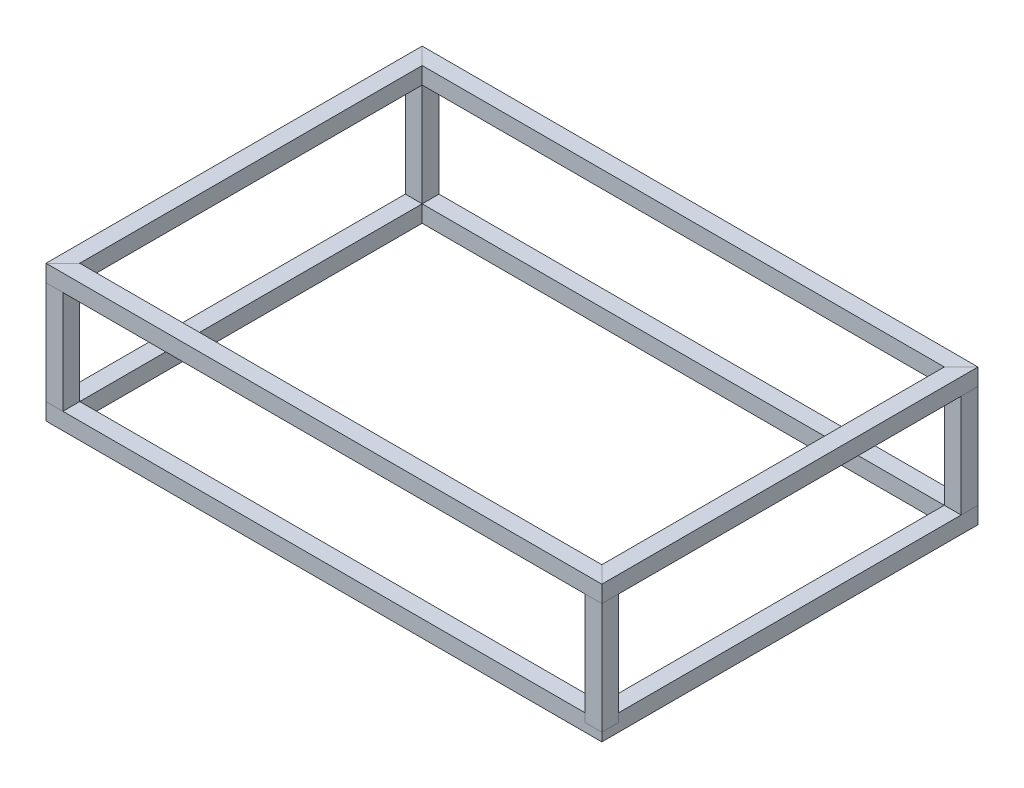
from build123d import *

# Parameters (mm, degrees)
SQUARE_TUBE_25_4X25_4X1_6_IGVC_1_DEPTH      = 935.623253942
SQUARE_TUBE_25_4X25_4X1_6_IGVC_1_DEPTH_BACK = 21.223253942
SKETCH14_W                                  = 28.6
SKETCH14_H                                  = 28.6
SKETCH14_W_2                                = 25.4
SKETCH14_H_2                                = 25.4
SKETCH14_ON_SEGMENT_2_W                     = 28.6
SKETCH14_ON_SEGMENT_2_H                     = 28.6
SKETCH14_ON_SEGMENT_2_W_2                   = 25.4
SKETCH14_ON_SEGMENT_2_H_2                   = 25.4
SQUARE_TUBE_25_4X25_4X1_6_IGVC_1_2_DEPTH    = 652.046507884
SKETCH14_ON_SEGMENT_3_W                     = 28.6
SKETCH14_ON_SEGMENT_3_H                     = 28.6
SKETCH14_ON_SEGMENT_3_W_2                   = 25.4
SKETCH14_ON_SEGMENT_3_H_2                   = 25.4
SQUARE_TUBE_25_4X25_4X1_6_IGVC_1_3_DEPTH    = 956.846507884
SKETCH14_ON_SEGMENT_4_W                     = 28.6
SKETCH14_ON_SEGMENT_4_H                     = 28.6
SKETCH14_ON_SEGMENT_4_W_2                   = 25.4
SKETCH14_ON_SEGMENT_4_H_2                   = 25.4
SQUARE_TUBE_25_4X25_4X1_6_IGVC_1_4_DEPTH    = 652.046507884
SKETCH15_W                                  = 28.6
SKETCH15_H                                  = 28.6
SKETCH15_W_2                                = 25.4
SKETCH15_H_2                                = 25.4
SQUARE_TUBE_25_4X25_4X1_6_IGVC_2_DEPTH      = 203.2
SKETCH15_ON_SEGMENT_2_W                     = 28.6
SKETCH15_ON_SEGMENT_2_H                     = 28.6
SKETCH15_ON_SEGMENT_2_W_2                   = 25.4
SKETCH15_ON_SEGMENT_2_H_2                   = 25.4
SQUARE_TUBE_25_4X25_4X1_6_IGVC_2_2_DEPTH    = 203.2
SKETCH15_ON_SEGMENT_3_W                     = 28.6
SKETCH15_ON_SEGMENT_3_H                     = 28.6
SKETCH15_ON_SEGMENT_3_W_2                   = 25.4
SKETCH15_ON_SEGMENT_3_H_2                   = 25.4
SQUARE_TUBE_25_4X25_4X1_6_IGVC_2_3_DEPTH    = 203.2
SKETCH15_ON_SEGMENT_4_W                     = 28.6
SKETCH15_ON_SEGMENT_4_H                     = 28.6
SKETCH15_ON_SEGMENT_4_W_2                   = 25.4
SKETCH15_ON_SEGMENT_4_H_2                   = 25.4
SQUARE_TUBE_25_4X25_4X1_6_IGVC_2_4_DEPTH    = 203.2
SQUARE_TUBE_25_4X25_4X1_6_IGVC_3_DEPTH      = 630.823253942
SQUARE_TUBE_25_4X25_4X1_6_IGVC_3_DEPTH_BACK = 21.223253942
SKETCH16_W                                  = 28.6
SKETCH16_H                                  = 28.6
SKETCH16_W_2                                = 25.4
SKETCH16_H_2                                = 25.4
SKETCH16_ON_SEGMENT_2_W                     = 28.6
SKETCH16_ON_SEGMENT_2_H                     = 28.6
SKETCH16_ON_SEGMENT_2_W_2                   = 25.4
SKETCH16_ON_SEGMENT_2_H_2                   = 25.4
SQUARE_TUBE_25_4X25_4X1_6_IGVC_3_2_DEPTH    = 956.846507884
SKETCH16_ON_SEGMENT_3_W                     = 28.6
SKETCH16_ON_SEGMENT_3_H                     = 28.6
SKETCH16_ON_SEGMENT_3_W_2                   = 25.4
SKETCH16_ON_SEGMENT_3_H_2                   = 25.4
SQUARE_TUBE_25_4X25_4X1_6_IGVC_3_3_DEPTH    = 652.046507884
SKETCH16_ON_SEGMENT_4_W                     = 28.6
SKETCH16_ON_SEGMENT_4_H                     = 28.6
SKETCH16_ON_SEGMENT_4_W_2                   = 25.4
SKETCH16_ON_SEGMENT_4_H_2                   = 25.4
SQUARE_TUBE_25_4X25_4X1_6_IGVC_3_4_DEPTH    = 956.846507884


with BuildPart() as part:
    # Sketch14 → Square tube 25.4X25.4X1.6_IGVC(1) (new, two sides: drawn at the far end of the back side and taken through both)
    with BuildSketch(Plane(origin=(-457.2, 0, 304.8), x_dir=(0, 0, -1), z_dir=(1, 0, 0)).offset(-SQUARE_TUBE_25_4X25_4X1_6_IGVC_1_DEPTH_BACK)):
        Rectangle(SKETCH14_W, SKETCH14_H)
        Rectangle(SKETCH14_W_2, SKETCH14_H_2, mode=Mode.SUBTRACT)
    extrude(amount=SQUARE_TUBE_25_4X25_4X1_6_IGVC_1_DEPTH + SQUARE_TUBE_25_4X25_4X1_6_IGVC_1_DEPTH_BACK)

    # Square tube 25.4X25.4X1.6_IGVC(1) mitre 1
    split(bisect_by=Plane(origin=(-457.2, 0, 304.8), x_dir=(0, 1, 0), z_dir=(0.707106781, 0, 0.707106781)), keep=Keep.TOP)

    # Square tube 25.4X25.4X1.6_IGVC(1) mitre 2
    split(bisect_by=Plane(origin=(457.2, 0, 304.8), x_dir=(0, -1, 0), z_dir=(-0.707106781, 0, 0.707106781)), keep=Keep.TOP)


with BuildPart() as body_2:
    # Sketch14 on segment 2 (carried to segment 2) → Square tube 25.4X25.4X1.6_IGVC_1 2 (new body)
    with BuildSketch(Plane(origin=(457.2, 0, 326.023253942), x_dir=(-1, 0, 0), z_dir=(0, 0, -1))):
        Rectangle(SKETCH14_ON_SEGMENT_2_W, SKETCH14_ON_SEGMENT_2_H)
        Rectangle(SKETCH14_ON_SEGMENT_2_W_2, SKETCH14_ON_SEGMENT_2_H_2, mode=Mode.SUBTRACT)
    extrude(amount=SQUARE_TUBE_25_4X25_4X1_6_IGVC_1_2_DEPTH)

    # Square tube 25.4X25.4X1.6_IGVC_1 2 mitre
    split(bisect_by=Plane(origin=(457.2, 0, -304.8), x_dir=(0, 1, 0), z_dir=(0.707106781, 0, 0.707106781)), keep=Keep.TOP)

    # Square tube 25.4X25.4X1.6_IGVC_1 2 m 2
    split(bisect_by=Plane(origin=(457.2, 0, 304.8), x_dir=(0, 1, 0), z_dir=(0.707106781, 0, -0.707106781)), keep=Keep.TOP)


with BuildPart() as body_3:
    # Sketch14 on segment 3 (carried to segment 3) → Square tube 25.4X25.4X1.6_IGVC_1 3 (new body)
    with BuildSketch(Plane(origin=(478.423253942, 0, -304.8), x_dir=(0, 0, 1), z_dir=(-1, 0, 0))):
        Rectangle(SKETCH14_ON_SEGMENT_3_W, SKETCH14_ON_SEGMENT_3_H)
        Rectangle(SKETCH14_ON_SEGMENT_3_W_2, SKETCH14_ON_SEGMENT_3_H_2, mode=Mode.SUBTRACT)
    extrude(amount=SQUARE_TUBE_25_4X25_4X1_6_IGVC_1_3_DEPTH)

    # Square tube 25.4X25.4X1.6_IGVC_1 3 mitre
    split(bisect_by=Plane(origin=(-457.2, 0, -304.8), x_dir=(0, 1, 0), z_dir=(0.707106781, 0, -0.707106781)), keep=Keep.TOP)

    # Square tube 25.4X25.4X1.6_IGVC_1 3 m 2
    split(bisect_by=Plane(origin=(457.2, 0, -304.8), x_dir=(0, -1, 0), z_dir=(-0.707106781, 0, -0.707106781)), keep=Keep.TOP)


with BuildPart() as body_4:
    # Sketch14 on segment 4 (carried to segment 4) → Square tube 25.4X25.4X1.6_IGVC_1 4 (new body)
    with BuildSketch(Plane(origin=(-457.2, 0, -326.023253942), x_dir=(1, 0, 0), z_dir=(0, 0, 1))):
        Rectangle(SKETCH14_ON_SEGMENT_4_W, SKETCH14_ON_SEGMENT_4_H)
        Rectangle(SKETCH14_ON_SEGMENT_4_W_2, SKETCH14_ON_SEGMENT_4_H_2, mode=Mode.SUBTRACT)
    extrude(amount=SQUARE_TUBE_25_4X25_4X1_6_IGVC_1_4_DEPTH)

    # Square tube 25.4X25.4X1.6_IGVC_1 4 mitre
    split(bisect_by=Plane(origin=(-457.2, 0, -304.8), x_dir=(0, -1, 0), z_dir=(-0.707106781, 0, 0.707106781)), keep=Keep.TOP)

    # Square tube 25.4X25.4X1.6_IGVC_1 4 m 2
    split(bisect_by=Plane(origin=(-457.2, 0, 304.8), x_dir=(0, -1, 0), z_dir=(-0.707106781, 0, -0.707106781)), keep=Keep.TOP)


with BuildPart() as body_5:
    # Sketch15 → Square tube 25.4X25.4X1.6_IGVC(2) (new body)
    with BuildSketch(Plane(origin=(-457.2, 0, 304.8), x_dir=(1, 0, 0), z_dir=(0, 1, 0))):
        Rectangle(SKETCH15_W, SKETCH15_H)
        Rectangle(SKETCH15_W_2, SKETCH15_H_2, mode=Mode.SUBTRACT)
    extrude(amount=SQUARE_TUBE_25_4X25_4X1_6_IGVC_2_DEPTH)


with BuildPart() as body_6:
    # Sketch15 on segment 2 (carried to segment 2) → Square tube 25.4X25.4X1.6_IGVC_2 2 (new body)
    with BuildSketch(Plane(origin=(457.2, 0, 304.8), x_dir=(1, 0, 0), z_dir=(0, 1, 0))):
        Rectangle(SKETCH15_ON_SEGMENT_2_W, SKETCH15_ON_SEGMENT_2_H)
        Rectangle(SKETCH15_ON_SEGMENT_2_W_2, SKETCH15_ON_SEGMENT_2_H_2, mode=Mode.SUBTRACT)
    extrude(amount=SQUARE_TUBE_25_4X25_4X1_6_IGVC_2_2_DEPTH)


with BuildPart() as body_7:
    # Sketch15 on segment 3 (carried to segment 3) → Square tube 25.4X25.4X1.6_IGVC_2 3 (new body)
    with BuildSketch(Plane(origin=(457.2, 0, -304.8), x_dir=(1, 0, 0), z_dir=(0, 1, 0))):
        Rectangle(SKETCH15_ON_SEGMENT_3_W, SKETCH15_ON_SEGMENT_3_H)
        Rectangle(SKETCH15_ON_SEGMENT_3_W_2, SKETCH15_ON_SEGMENT_3_H_2, mode=Mode.SUBTRACT)
    extrude(amount=SQUARE_TUBE_25_4X25_4X1_6_IGVC_2_3_DEPTH)


with BuildPart() as body_8:
    # Sketch15 on segment 4 (carried to segment 4) → Square tube 25.4X25.4X1.6_IGVC_2 4 (new body)
    with BuildSketch(Plane(origin=(-457.2, 0, -304.8), x_dir=(1, 0, 0), z_dir=(0, 1, 0))):
        Rectangle(SKETCH15_ON_SEGMENT_4_W, SKETCH15_ON_SEGMENT_4_H)
        Rectangle(SKETCH15_ON_SEGMENT_4_W_2, SKETCH15_ON_SEGMENT_4_H_2, mode=Mode.SUBTRACT)
    extrude(amount=SQUARE_TUBE_25_4X25_4X1_6_IGVC_2_4_DEPTH)


with BuildPart() as body_9:
    # Sketch16 → Square tube 25.4X25.4X1.6_IGVC(3) (new, two sides: drawn at the far end of the back side and taken through both)
    with BuildSketch(Plane(origin=(-457.2, 203.2, -304.8), x_dir=(1, 0, 0), z_dir=(0, 0, 1)).offset(-SQUARE_TUBE_25_4X25_4X1_6_IGVC_3_DEPTH_BACK)):
        Rectangle(SKETCH16_W, SKETCH16_H)
        Rectangle(SKETCH16_W_2, SKETCH16_H_2, mode=Mode.SUBTRACT)
    extrude(amount=SQUARE_TUBE_25_4X25_4X1_6_IGVC_3_DEPTH + SQUARE_TUBE_25_4X25_4X1_6_IGVC_3_DEPTH_BACK)

    # Square tube 25.4X25.4X1.6_IGVC(3) mitre 1
    split(bisect_by=Plane(origin=(-457.2, 203.2, -304.8), x_dir=(0, -1, 0), z_dir=(-0.707106781, 0, 0.707106781)), keep=Keep.TOP)

    # Square tube 25.4X25.4X1.6_IGVC(3) mitre 2
    split(bisect_by=Plane(origin=(-457.2, 203.2, 304.8), x_dir=(0, -1, 0), z_dir=(-0.707106781, 0, -0.707106781)), keep=Keep.TOP)


with BuildPart() as body_10:
    # Sketch16 on segment 2 (carried to segment 2) → Square tube 25.4X25.4X1.6_IGVC_3 2 (new body)
    with BuildSketch(Plane(origin=(-478.423253942, 203.2, 304.8), x_dir=(0, 0, -1), z_dir=(1, 0, 0))):
        Rectangle(SKETCH16_ON_SEGMENT_2_W, SKETCH16_ON_SEGMENT_2_H)
        Rectangle(SKETCH16_ON_SEGMENT_2_W_2, SKETCH16_ON_SEGMENT_2_H_2, mode=Mode.SUBTRACT)
    extrude(amount=SQUARE_TUBE_25_4X25_4X1_6_IGVC_3_2_DEPTH)

    # Square tube 25.4X25.4X1.6_IGVC_3 2 mitre
    split(bisect_by=Plane(origin=(-457.2, 203.2, 304.8), x_dir=(0, 1, 0), z_dir=(0.707106781, 0, 0.707106781)), keep=Keep.TOP)

    # Square tube 25.4X25.4X1.6_IGVC_3 2 m 2
    split(bisect_by=Plane(origin=(457.2, 203.2, 304.8), x_dir=(0, -1, 0), z_dir=(-0.707106781, 0, 0.707106781)), keep=Keep.TOP)


with BuildPart() as body_11:
    # Sketch16 on segment 3 (carried to segment 3) → Square tube 25.4X25.4X1.6_IGVC_3 3 (new body)
    with BuildSketch(Plane(origin=(457.2, 203.2, 326.023253942), x_dir=(-1, 0, 0), z_dir=(0, 0, -1))):
        Rectangle(SKETCH16_ON_SEGMENT_3_W, SKETCH16_ON_SEGMENT_3_H)
        Rectangle(SKETCH16_ON_SEGMENT_3_W_2, SKETCH16_ON_SEGMENT_3_H_2, mode=Mode.SUBTRACT)
    extrude(amount=SQUARE_TUBE_25_4X25_4X1_6_IGVC_3_3_DEPTH)

    # Square tube 25.4X25.4X1.6_IGVC_3 3 mitre
    split(bisect_by=Plane(origin=(457.2, 203.2, -304.8), x_dir=(0, 1, 0), z_dir=(0.707106781, 0, 0.707106781)), keep=Keep.TOP)

    # Square tube 25.4X25.4X1.6_IGVC_3 3 m 2
    split(bisect_by=Plane(origin=(457.2, 203.2, 304.8), x_dir=(0, 1, 0), z_dir=(0.707106781, 0, -0.707106781)), keep=Keep.TOP)


with BuildPart() as body_12:
    # Sketch16 on segment 4 (carried to segment 4) → Square tube 25.4X25.4X1.6_IGVC_3 4 (new body)
    with BuildSketch(Plane(origin=(478.423253942, 203.2, -304.8), x_dir=(0, 0, 1), z_dir=(-1, 0, 0))):
        Rectangle(SKETCH16_ON_SEGMENT_4_W, SKETCH16_ON_SEGMENT_4_H)
        Rectangle(SKETCH16_ON_SEGMENT_4_W_2, SKETCH16_ON_SEGMENT_4_H_2, mode=Mode.SUBTRACT)
    extrude(amount=SQUARE_TUBE_25_4X25_4X1_6_IGVC_3_4_DEPTH)

    # Square tube 25.4X25.4X1.6_IGVC_3 4 mitre
    split(bisect_by=Plane(origin=(-457.2, 203.2, -304.8), x_dir=(0, 1, 0), z_dir=(0.707106781, 0, -0.707106781)), keep=Keep.TOP)

    # Square tube 25.4X25.4X1.6_IGVC_3 4 m 2
    split(bisect_by=Plane(origin=(457.2, 203.2, -304.8), x_dir=(0, -1, 0), z_dir=(-0.707106781, 0, -0.707106781)), keep=Keep.TOP)


solid = Compound([part.part, body_2.part, body_3.part, body_4.part, body_5.part, body_6.part, body_7.part, body_8.part, body_9.part, body_10.part, body_11.part, body_12.part])
